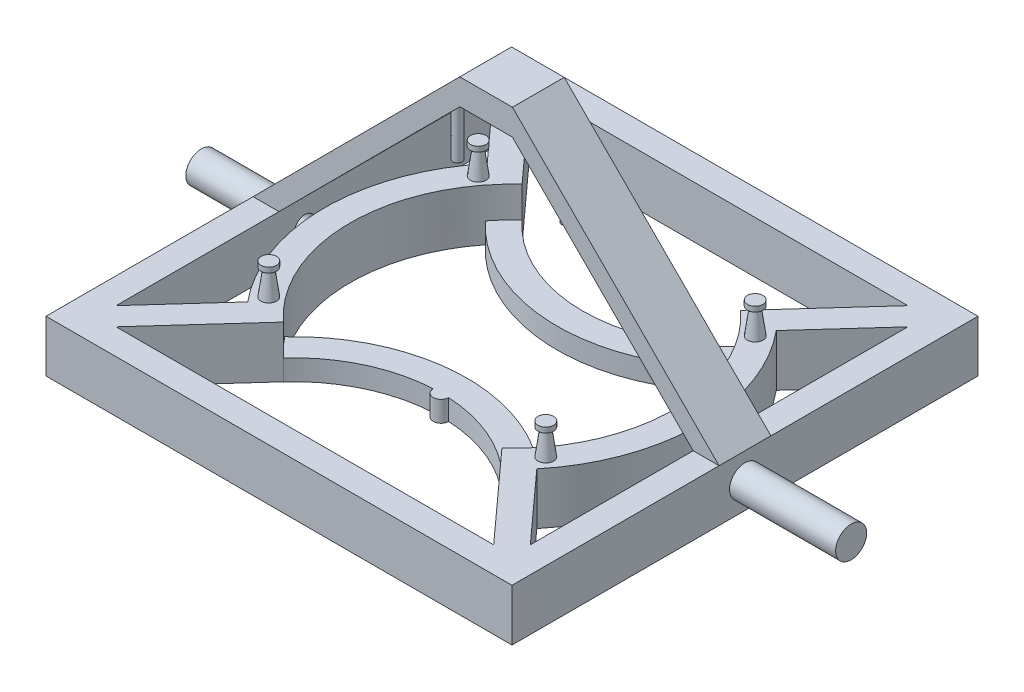
from build123d import *

# Parameters (mm, degrees)
SKETCH1_W                   = 90
SKETCH1_H                   = 90
SKETCH1_W_2                 = 80
SKETCH1_H_2                 = 80
BOSS_EXTRUDE1_DEPTH         = 10
SKETCH2_R                   = 3
BOSS_EXTRUDE2_DEPTH         = 20.5
BOSS_EXTRUDE3_DEPTH         = 5
BOSS_EXTRUDE3_DEPTH_BACK    = 5
BOSS_EXTRUDE4_START         = 15
SKETCH4_R                   = 3
BOSS_EXTRUDE4_DEPTH         = 15
BOSS_EXTRUDE5_DEPTH         = 10
BOSS_EXTRUDE6_DEPTH         = 4
SKETCH8_R                   = 1.5
BOSS_EXTRUDE7_DEPTH         = 5
BOSS_EXTRUDE7_TAPER         = 8
SKETCH9_R                   = 1.5
POST_FOR_RUBBER_BANDS_DEPTH = 1
MIRROR3_COPY_1_SKETCH_R     = 1.5
MIRROR3_COPY_1_DEPTH        = 5
MIRROR3_COPY_1_TAPER        = 8
MIRROR3_COPY_2_SKETCH_R     = 1.5
MIRROR3_COPY_2_DEPTH        = 1
SKETCH12_R                  = 0.889
BOSS_EXTRUDE10_DEPTH        = 10
CUT_EXTRUDE1_REACH          = 144.391
SKETCH13_R                  = 2


with BuildPart() as part:
    # Sketch1 → Boss-Extrude1 (new body)
    with BuildSketch(Plane(origin=(0, 0, 0), x_dir=(1, 0, 0), z_dir=(0, 1, 0))):
        Rectangle(SKETCH1_W, SKETCH1_H)
        Rectangle(SKETCH1_W_2, SKETCH1_H_2, mode=Mode.SUBTRACT)
    extrude(amount=BOSS_EXTRUDE1_DEPTH)

    # Sketch2 → Boss-Extrude2 (add)
    with BuildSketch(Plane(origin=(45, 0, 0), x_dir=(0, 0, -1), z_dir=(1, 0, 0))):
        with Locations(Location((0, 5, 0), (0, 0, 180))):
            Circle(SKETCH2_R)
    extrude(amount=BOSS_EXTRUDE2_DEPTH)

    # Sketch3 → Boss-Extrude3 (add, two sides: drawn at the far end of the back side and taken through both)
    with BuildSketch(Plane.XY.offset(-BOSS_EXTRUDE3_DEPTH_BACK)):
        Polygon((-40, 10), (-45, 10), (-5.084464777, 50), (5.084464777, 50), (45, 10), (40, 10), (5.07390668, 45), (-5.07390668, 45), align=None)
    extrude(amount=BOSS_EXTRUDE3_DEPTH + BOSS_EXTRUDE3_DEPTH_BACK)

    # Sketch4 → Boss-Extrude4 (add)
    with BuildSketch(Plane.ZY.offset(45).offset(BOSS_EXTRUDE4_START)):
        with Locations((0, 5)):
            Circle(SKETCH4_R)
    extrude(amount=-BOSS_EXTRUDE4_DEPTH)

    # Sketch5 → Boss-Extrude5 (add)
    with BuildSketch(Plane(origin=(0, 0, 0), x_dir=(1, 0, 0), z_dir=(0, 1, 0))):
        with BuildLine():
            Line((-40, -36.460175656), (-40, -40))
            Line((-40, -40), (-36.460175656, -40))
            Line((-36.460175656, -40), (-21.10179716, -23.0494394))
            ThreePointArc((-21.10179716, -23.0494394), (-31.25, 0), (-21.10179716, 23.0494394))
            Line((-21.10179716, 23.0494394), (-36.460175656, 40))
            Line((-36.460175656, 40), (-40, 40))
            Line((-40, 40), (-40, 36.460175656))
            Line((-40, 36.460175656), (-27.916615548, 23.124123255))
            ThreePointArc((-27.916615548, 23.124123255), (-36.25, 0), (-27.916615548, -23.124123255))
            Line((-27.916615548, -23.124123255), (-40, -36.460175656))
        make_face()
    boss_extrude5 = extrude(amount=BOSS_EXTRUDE5_DEPTH)

    # Mirror1: Boss-Extrude5 across plane
    add(boss_extrude5.mirror(Plane(origin=(0, 0, 0), x_dir=(0, 0, 1), z_dir=(1, 0, 0))))

    # Sketch6 → Boss-Extrude6 (add)
    with BuildSketch(Plane(origin=(0, 0, 0), x_dir=(1, 0, 0), z_dir=(0, 1, 0))):
        with BuildLine():
            ThreePointArc((-21.10179716, 23.0494394), (-22.883440442, 21.281697619), (-24.517477668, 19.376681574))
            ThreePointArc((-24.517477668, 19.376681574), (0, 8.693728204), (24.517477668, 19.376681574))
            ThreePointArc((24.517477668, 19.376681574), (22.883440442, 21.281697619), (21.10179716, 23.0494394))
            ThreePointArc((21.10179716, 23.0494394), (0, 13.693728204), (-21.10179716, 23.0494394))
        make_face()
        with BuildLine():
            ThreePointArc((-24.517477668, -19.376681574), (0, -8.693728204), (24.517477668, -19.376681574))
            ThreePointArc((24.517477668, -19.376681574), (22.883440442, -21.281697619), (21.10179716, -23.0494394))
            ThreePointArc((21.10179716, -23.0494394), (12.223024974, -16.450534785), (1.499479621, -13.733235994))
            ThreePointArc((1.499479621, -13.733235994), (0, -15.193728204), (-1.499479621, -13.733235994))
            ThreePointArc((-1.499479621, -13.733235994), (-12.223024974, -16.450534785), (-21.10179716, -23.0494394))
            ThreePointArc((-21.10179716, -23.0494394), (-22.883440442, -21.281697619), (-24.517477668, -19.376681574))
        make_face()
    extrude(amount=BOSS_EXTRUDE6_DEPTH)

    # Sketch8 → Boss-Extrude7 (add)
    with BuildSketch(Plane(origin=(0, 10, 0), x_dir=(1, 0, 0), z_dir=(0, 1, 0))):
        with Locations((-26.75, 20.224123255)):
            Circle(SKETCH8_R)
    boss_extrude7 = extrude(amount=BOSS_EXTRUDE7_DEPTH, taper=BOSS_EXTRUDE7_TAPER)

    # Sketch9 → Post for rubber bands (add)
    with BuildSketch(Plane(origin=(0, 15, 0), x_dir=(1, 0, 0), z_dir=(0, 1, 0))):
        with Locations(Location((-26.75, 20.224123255, 0), (0, 0, 270))):
            Circle(SKETCH9_R)
    post_for_rubber_bands = extrude(amount=POST_FOR_RUBBER_BANDS_DEPTH)

    # Mirror2: Boss-Extrude7, Post for rubber bands across plane
    add(boss_extrude7.mirror(Plane(origin=(0, 0, 0), x_dir=(0, 0, 1), z_dir=(1, 0, 0))))
    add(post_for_rubber_bands.mirror(Plane(origin=(0, 0, 0), x_dir=(0, 0, 1), z_dir=(1, 0, 0))))

    # Mirror3: Boss-Extrude7, Post for rubber bands across plane
    add(boss_extrude7.mirror(Plane.XY))
    add(post_for_rubber_bands.mirror(Plane.XY))

    # Mirror3 copy 1 sketch → Mirror3 copy 1 (add)
    with BuildSketch(Plane(origin=(0, 10, 0), x_dir=(-1, 0, 0), z_dir=(0, 1, 0))):
        with Locations((-26.75, 20.224123255)):
            Circle(MIRROR3_COPY_1_SKETCH_R)
    extrude(amount=MIRROR3_COPY_1_DEPTH, taper=MIRROR3_COPY_1_TAPER)

    # Mirror3 copy 2 sketch → Mirror3 copy 2 (add)
    with BuildSketch(Plane(origin=(0, 15, 0), x_dir=(-1, 0, 0), z_dir=(0, 1, 0))):
        with Locations(Location((-26.75, 20.224123255, 0), (0, 0, 270))):
            Circle(MIRROR3_COPY_2_SKETCH_R)
    extrude(amount=MIRROR3_COPY_2_DEPTH)

    # Sketch12 → Boss-Extrude10 (add)
    with BuildSketch(Plane(origin=(0, 41, 0), x_dir=(-1, 0, 0), z_dir=(0, -1, 0))):
        with Locations((-10.5, 0)):
            Circle(SKETCH12_R)
        with Locations(Location((10.5, 0, 0), (0, 0, 180))):
            Circle(SKETCH12_R)
    extrude(amount=BOSS_EXTRUDE10_DEPTH)

    # Sketch13 → Cut-Extrude1 (cut, up to next)
    with BuildSketch(Plane.ZY.offset(60), mode=Mode.PRIVATE) as cut_extrude1_sk1:
        with Locations((0, 5)):
            Circle(SKETCH13_R)
    cut_extrude1_tool1 = extrude(cut_extrude1_sk1.sketch, amount=-CUT_EXTRUDE1_REACH, mode=Mode.PRIVATE) & part.part
    add(cut_extrude1_tool1.solids().sort_by_distance((-60, 5, 0))[0], mode=Mode.SUBTRACT)


solid = part.part
